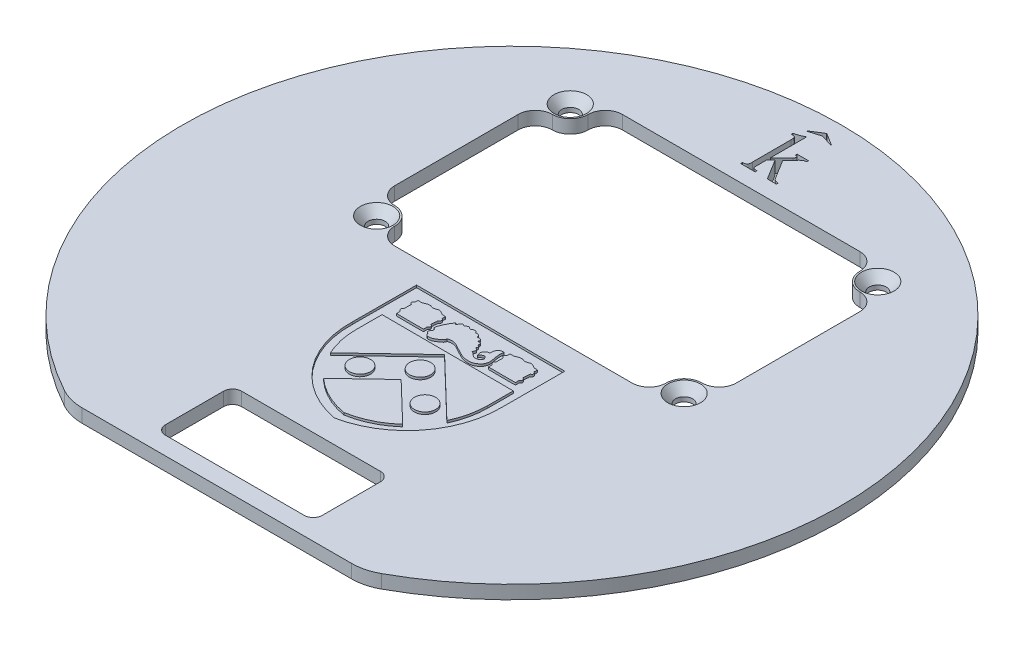
from build123d import *
from OCP.BRepFilletAPI import BRepFilletAPI_MakeChamfer

# Parameters (mm, degrees)
BOSS_EXTRUDE1_DEPTH = 3
SKETCH2_R           = 1.905
CUT_EXTRUDE1_DEPTH  = 104.987980075
SKETCH3_R           = 2.359015219
CUT_EXTRUDE2_DEPTH  = 0.5
CUT_EXTRUDE3_DEPTH  = 104.974756693
CHAMFER1_SIZE       = 2
CHAMFER1_SIZE2      = 1.738573476


with BuildPart() as part:
    # Sketch1 → Boss-Extrude1 (new body)
    with BuildSketch(Plane(origin=(0, 0, 0), x_dir=(1, 0, 0), z_dir=(0, 1, 0))):
        with BuildLine():
            Line((-30.029977361, -65.812867647), (30.029977361, -65.812867647))
            ThreePointArc((30.029977361, -65.812867647), (32.757823419, -65.469267409), (35.315253377, -64.459932353))
            ThreePointArc((35.315253377, -64.459932353), (0, 73.5), (-35.315253377, -64.459932353))
            ThreePointArc((-35.315253377, -64.459932353), (-32.757823419, -65.469267409), (-30.029977361, -65.812867647))
        make_face()
    extrude(amount=BOSS_EXTRUDE1_DEPTH)

    # Sketch2 → Cut-Extrude1 (cut, through all)
    with BuildSketch(Plane(origin=(0, 3, 0), x_dir=(1, 0, 0), z_dir=(0, 1, 0))):
        with Locations(Location((34.29, 4.117132353, 0), (0, 0, 270))):
            Circle(SKETCH2_R)
        with Locations(Location((-34.29, 4.117132353, 0), (0, 0, 270))):
            Circle(SKETCH2_R)
        with Locations(Location((34.29, 47.297132353, 0), (0, 0, 270))):
            Circle(SKETCH2_R)
        with Locations(Location((-34.29, 47.297132353, 0), (0, 0, 270))):
            Circle(SKETCH2_R)
        with BuildLine():
            Line((-38.1, 11.927132353), (-38.1, 39.487132353))
            ThreePointArc((-38.1, 39.487132353), (-36.984076836, 42.181209189), (-34.29, 43.297132353))
            ThreePointArc((-34.29, 43.297132353), (-31.461572875, 44.468705228), (-30.29, 47.297132353))
            ThreePointArc((-30.29, 47.297132353), (-29.174076836, 49.991209189), (-26.48, 51.107132353))
            Line((-26.48, 51.107132353), (26.48, 51.107132353))
            ThreePointArc((26.48, 51.107132353), (29.174076836, 49.991209189), (30.29, 47.297132353))
            ThreePointArc((30.29, 47.297132353), (31.461572875, 44.468705228), (34.29, 43.297132353))
            ThreePointArc((34.29, 43.297132353), (36.984076836, 42.181209189), (38.1, 39.487132353))
            Line((38.1, 39.487132353), (38.1, 11.927132353))
            ThreePointArc((38.1, 11.927132353), (36.984076836, 9.233055517), (34.29, 8.117132353))
            ThreePointArc((34.29, 8.117132353), (31.461572875, 6.945559478), (30.29, 4.117132353))
            ThreePointArc((30.29, 4.117132353), (29.174076836, 1.423055517), (26.48, 0.307132353))
            Line((26.48, 0.307132353), (-26.48, 0.307132353))
            ThreePointArc((-26.48, 0.307132353), (-29.174076836, 1.423055517), (-30.29, 4.117132353))
            ThreePointArc((-30.29, 4.117132353), (-31.461572875, 6.945559478), (-34.29, 8.117132353))
            ThreePointArc((-34.29, 8.117132353), (-36.984076836, 9.233055517), (-38.1, 11.927132353))
        make_face()
        with BuildLine():
            Line((-15.5, -61.812867647), (15.5, -61.812867647))
            ThreePointArc((15.5, -61.812867647), (16.914213562, -61.227081209), (17.5, -59.812867647))
            Line((17.5, -59.812867647), (17.5, -46.812867647))
            ThreePointArc((17.5, -46.812867647), (16.914213562, -45.398654085), (15.5, -44.812867647))
            Line((15.5, -44.812867647), (-15.5, -44.812867647))
            ThreePointArc((-15.5, -44.812867647), (-16.914213562, -45.398654085), (-17.5, -46.812867647))
            Line((-17.5, -46.812867647), (-17.5, -59.812867647))
            ThreePointArc((-17.5, -59.812867647), (-16.914213562, -61.227081209), (-15.5, -61.812867647))
        make_face()
    extrude(amount=-CUT_EXTRUDE1_DEPTH, mode=Mode.SUBTRACT)

    # Sketch3 → Cut-Extrude2 (cut)
    # profile 1 of 3: a face of its own
    with BuildSketch(Plane(origin=(0, 3, 0), x_dir=(1, 0, 0), z_dir=(0, 1, 0))):
        with BuildLine():
            Line((-2.693134868, 68.535327227), (-0.026575904, 70.208580735))
            ThreePointArc((-0.026575904, 70.208580735), (0, 70.216228387), (0.026575904, 70.208580735))
            Line((0.026575904, 70.208580735), (2.693134868, 68.535327227))
            ThreePointArc((2.693134868, 68.535327227), (2.712147073, 68.472438951), (2.652448687, 68.445007182))
            Line((2.652448687, 68.445007182), (0, 69.225256992))
            Line((0, 69.225256992), (-2.652448687, 68.445007182))
            ThreePointArc((-2.652448687, 68.445007182), (-2.712147073, 68.472438951), (-2.693134868, 68.535327227))
        make_face()
    # profile 2 of 3: a face of its own
    with BuildSketch(Plane(origin=(0, 3, 0), x_dir=(1, 0, 0), z_dir=(0, 1, 0))):
        with BuildLine():
            Line((-1.588743463, 67.164413263), (-1.755732468, 67.278490361))
            add(Edge.make_bspline(
                [(-1.755732468, 67.278490361), (-1.832549533, 67.227230697), (-1.984648639, 67.125735685), (-2.222419823, 66.994786105), (-2.464077879, 66.881851597), (-2.710596565, 66.781135583), (-2.969569879, 66.697164946), (-3.241490234, 66.621894904), (-3.530063909, 66.557581345), (-3.728806169, 66.526124216), (-3.830845923, 66.509973259)],
                knots=[0, 0, 0, 0, 0.99219527, 1.964563641, 2.913725659, 3.858095412, 4.824613577, 5.837792226, 6.889862931, 8, 8, 8, 8], degree=3))
            Line((-3.830845923, 66.509973259), (-3.829172774, 66.108082379))
            add(Edge.make_bspline(
                [(-3.829172774, 66.108082379), (-3.774105613, 66.108409425), (-3.668873212, 66.109034404), (-3.518862518, 66.104840232), (-3.383546213, 66.094375577), (-3.265155852, 66.072782419), (-3.160883193, 66.04731835), (-3.071553221, 66.014268735), (-3.000266077, 65.967658065), (-2.939938984, 65.917450087), (-2.893339202, 65.851862148), (-2.857199347, 65.771699484), (-2.826894126, 65.675281315), (-2.800684924, 65.56392077), (-2.786418221, 65.435385438), (-2.772957389, 65.291284648), (-2.772796419, 65.130361874), (-2.774640292, 65.017575593), (-2.775600635, 64.958833192)],
                knots=[0, 0, 0, 0, 1.376985379, 2.631395473, 3.752347301, 4.766905578, 5.636427879, 6.436770196, 7.132443207, 7.75719583, 8.388061638, 9.12420934, 9.948179583, 10.912904473, 11.979647863, 13.178681864, 14.530574826, 16, 16, 16, 16], degree=3))
            Line((-2.775600635, 64.958833192), (-2.773252718, 56.449231137))
            add(Edge.make_bspline(
                [(-2.773252718, 56.449231137), (-2.772214018, 56.387960757), (-2.770219198, 56.270291156), (-2.771391408, 56.102281121), (-2.78161931, 55.951842556), (-2.793829567, 55.817970102), (-2.817575395, 55.701848787), (-2.845765127, 55.602072587), (-2.877117213, 55.517481564), (-2.921124144, 55.448626542), (-2.977544093, 55.391778016), (-3.050669341, 55.347485193), (-3.138631439, 55.310304699), (-3.243321352, 55.279320759), (-3.366524711, 55.259910615), (-3.506162492, 55.245514471), (-3.663203904, 55.241809344), (-3.772882826, 55.244162486), (-3.830845923, 55.245406074)],
                knots=[0, 0, 0, 0, 1.483538914, 2.84913251, 4.065244707, 5.13334905, 6.100365284, 6.92875801, 7.643656089, 8.274928736, 8.891793445, 9.565242324, 10.329735783, 11.199843743, 12.200672305, 13.344232496, 14.596480465, 16, 16, 16, 16], degree=3))
            Line((-3.830845923, 55.245406074), (-3.829172774, 54.812967025))
            Line((-3.829172774, 54.812967025), (-0.581273582, 54.812967025))
            Line((-0.581273582, 54.812967025), (-0.581273582, 55.24540837))
            add(Edge.make_bspline(
                [(-0.581273582, 55.24540837), (-0.636624311, 55.24420349), (-0.741337005, 55.241924095), (-0.890368116, 55.245104299), (-1.022656679, 55.26091815), (-1.139693889, 55.27701726), (-1.240903316, 55.305564858), (-1.324498674, 55.342477108), (-1.394120006, 55.385368645), (-1.448069464, 55.439170402), (-1.489772573, 55.506887158), (-1.520871776, 55.590297977), (-1.549437281, 55.689117264), (-1.569863128, 55.804919825), (-1.582989702, 55.937697493), (-1.592695809, 56.087409328), (-1.5947235, 56.254472442), (-1.590798425, 56.371167749), (-1.588743463, 56.432263247)],
                knots=[0, 0, 0, 0, 1.377886396, 2.606690134, 3.704658506, 4.691806464, 5.543360921, 6.311374855, 6.960297786, 7.566839843, 8.188849503, 8.923736021, 9.775290478, 10.746525042, 11.844493415, 13.094607919, 14.478890205, 16, 16, 16, 16], degree=3))
            Line((-1.588743463, 56.432263247), (-1.588743463, 58.336304663))
            Line((-1.588743463, 58.336304663), (-0.630022125, 59.328645052))
            Line((-0.630022125, 59.328645052), (2.143462401, 54.812967025))
            Line((2.143462401, 54.812967025), (4.166694463, 54.812967025))
            Line((4.166694463, 54.812967025), (4.166694463, 55.22995297))
            add(Edge.make_bspline(
                [(4.166694463, 55.22995297), (4.101669564, 55.227779441), (3.975059113, 55.223547346), (3.791318365, 55.247963099), (3.617114107, 55.28107136), (3.451013431, 55.337922782), (3.290164055, 55.426269638), (3.14173098, 55.562509347), (2.992374305, 55.733567663), (2.907560866, 55.870671313), (2.862558488, 55.943419105)],
                knots=[0, 0, 0, 0, 0.984414491, 1.91676056, 2.801699979, 3.669179448, 4.567638625, 5.560693888, 6.705693592, 8, 8, 8, 8], degree=3))
            Line((2.862558488, 55.943419105), (0.27995067, 60.125770939))
            Line((0.27995067, 60.125770939), (2.065118169, 61.947772965))
            add(Edge.make_bspline(
                [(2.065118169, 61.947772965), (2.110902524, 61.994071272), (2.199304609, 62.083465714), (2.336921668, 62.200200215), (2.471286429, 62.296283635), (2.606282717, 62.369151508), (2.746476352, 62.421547331), (2.894516119, 62.459143642), (3.054623606, 62.480897436), (3.164883856, 62.481431944), (3.222140958, 62.481709509)],
                knots=[0, 0, 0, 0, 1.184269341, 2.286629972, 3.279203951, 4.18475382, 5.068961587, 5.99547167, 6.959067459, 8, 8, 8, 8], degree=3))
            Line((3.222140958, 62.481709509), (3.224488875, 62.916496475))
            Line((3.224488875, 62.916496475), (0.686259674, 62.916496475))
            Line((0.686259674, 62.916496475), (0.686259674, 62.484055131))
            add(Edge.make_bspline(
                [(0.686259674, 62.484055131), (0.73326394, 62.482797536), (0.821882979, 62.480426541), (0.946169955, 62.472500426), (1.051117411, 62.455462252), (1.137972063, 62.437306415), (1.202696668, 62.405693423), (1.251526189, 62.370618052), (1.280581111, 62.323571899), (1.280772082, 62.289323123), (1.280865662, 62.272540621)],
                knots=[0, 0, 0, 0, 1.638837204, 3.089765864, 4.332966459, 5.345953299, 6.163994169, 6.824817916, 7.424140098, 8, 8, 8, 8], degree=3))
            add(Edge.make_bspline(
                [(1.280865662, 62.272540621), (1.27480377, 62.239006334), (1.260695753, 62.160961012), (1.186515825, 62.043760246), (1.07625371, 61.910067192), (0.985645134, 61.818202456), (0.935384465, 61.767244993)],
                knots=[0, 0, 0, 0, 0.651763068, 1.516867163, 2.622603691, 4, 4, 4, 4], degree=3))
            Line((0.935384465, 61.767244993), (-1.556244434, 59.247305676))
            Line((-1.556244434, 59.247305676), (-1.588743463, 59.247305676))
            Line((-1.588743463, 59.247305676), (-1.588743463, 67.164413263))
        make_face()
    # profile 3 of 3: a face of its own
    with BuildSketch(Plane(origin=(0, 3, 0), x_dir=(1, 0, 0), z_dir=(0, 1, 0))):
        with BuildLine():
            Line((-16.470981421, -4.808010158), (10.814898306, -4.897023363))
            Line((10.814898306, -4.897023363), (16.697915401, -4.916215202))
            Line((16.697915401, -4.916215202), (16.651431044, -19.165410763))
            ThreePointArc((16.651431044, -19.165410763), (12.00738353, -32.398319242), (0, -39.643992771))
            ThreePointArc((0, -39.643992771), (-12.053441019, -32.395220123), (-16.517465778, -19.057205718))
            Line((-16.517465778, -19.057205718), (-16.485508628, -9.261142746))
            Line((-16.485508628, -9.261142746), (-16.470981421, -4.808010158))
        make_face()
        with Locations(Location((7.320101243, -26.708540039, 0), (0, 0, 270))):
            Circle(SKETCH3_R, mode=Mode.SUBTRACT)
        with Locations(Location((-7.235549125, -26.661055951, 0), (0, 0, 270))):
            Circle(SKETCH3_R, mode=Mode.SUBTRACT)
        with Locations(Location((0.062321726, -20.540050638, 0), (0, 0, 270))):
            Circle(SKETCH3_R, mode=Mode.SUBTRACT)
        with BuildLine():
            Line((0.08004657, -15.106722514), (13.074502178, -27.588397202))
            ThreePointArc((13.074502178, -27.588397202), (14.314771928, -23.960219393), (14.743209199, -20.149919566))
            Line((14.743209199, -20.149919566), (14.761768322, -14.460853553))
            Line((14.761768322, -14.460853553), (-14.597148773, -14.365077594))
            Line((-14.597148773, -14.365077594), (-14.615707897, -20.054143607))
            ThreePointArc((-14.615707897, -20.054143607), (-14.212139737, -23.867157639), (-12.995568138, -27.503350264))
            Line((-12.995568138, -27.503350264), (0.08004657, -15.106722514))
        make_face(mode=Mode.SUBTRACT)
        with BuildLine():
            Line((-8.831024098, -33.187528193), (0.048525621, -24.769073313))
            Line((0.048525621, -24.769073313), (8.872960818, -33.245282917))
            ThreePointArc((8.872960818, -33.245282917), (4.743370964, -36.011033202), (0.006937525, -37.517381529))
            ThreePointArc((0.006937525, -37.517381529), (-4.719567054, -35.980162786), (-8.831024098, -33.187528193))
        make_face(mode=Mode.SUBTRACT)
        with BuildLine():
            add(Edge.make_bspline(
                [(7.357481872, -12.279858863), (7.355766939, -12.333701089), (7.352220775, -12.408052634), (7.349794751, -12.500685791), (7.355203186, -12.548150367), (7.351186054, -12.607988403), (7.429007705, -12.602929343), (7.610022366, -12.597956659), (8.143286982, -12.614119636), (8.918189984, -12.593542954), (9.762189895, -12.622671503), (10.412098456, -12.630977508), (10.899551074, -12.625876241), (11.307518252, -12.620157453), (11.684828624, -12.625524183), (12.026324142, -12.61760064), (12.340781403, -12.621676176), (12.650501648, -12.618344428), (12.93987421, -12.603267434), (13.163825069, -12.614130375), (13.349541705, -12.598234942), (13.39827292, -12.42891283), (13.377358709, -12.250943536), (13.388788502, -12.053250365), (13.377015895, -11.882422209), (13.408323565, -11.747661847), (13.523677747, -11.653503991), (13.628137383, -11.522170953), (13.725030966, -11.341311532), (13.665148976, -11.159483782), (13.585923053, -11.013460721), (13.4395977, -10.957312897), (13.26762091, -10.915046329), (13.321766563, -10.673652565), (13.325104231, -10.41146718), (13.333974438, -10.059253124), (13.405952532, -9.750322426), (13.37930486, -9.506093906), (13.432032803, -9.289021617), (13.607672713, -9.235324534), (13.758139316, -9.085510044), (13.698470298, -8.887396451), (13.735316394, -8.699363678), (13.635823239, -8.605665792), (13.534539249, -8.537487629), (13.351608182, -8.501212057), (13.450352391, -8.281032301), (13.416072214, -8.05756016), (13.429551774, -7.918046969), (13.424786232, -7.807931108)],
                knots=[0.498850529, 0.498850529, 0.498850529, 0.498850529, 0.505805281, 0.508518005, 0.510586676, 0.512308685, 0.514943831, 0.518127891, 0.537690902, 0.580941513, 0.619697701, 0.645981713, 0.664756575, 0.682488522, 0.698550468, 0.713362303, 0.726503895, 0.739021436, 0.753420653, 0.763224698, 0.769274242, 0.774450138, 0.783248293, 0.792985724, 0.799592531, 0.805526644, 0.809721918, 0.818280397, 0.827588735, 0.83398197, 0.842184813, 0.847585853, 0.85446252, 0.860726442, 0.874345035, 0.890729688, 0.905221659, 0.914603521, 0.922884949, 0.930829358, 0.936714161, 0.948198451, 0.954622091, 0.959784459, 0.964102621, 0.971407316, 0.977533935, 0.989080574, 1, 1, 1, 1], degree=3))
            add(Edge.make_bspline(
                [(13.424786232, -7.807931108), (13.42460476, -7.803737886), (13.422625928, -7.761192179), (13.421060085, -7.705343524), (13.352096043, -7.717711127), (13.277186229, -7.718426819), (13.131955229, -7.712268831), (12.924298537, -7.721058476), (12.700789954, -7.69245505), (12.501561819, -7.607437261), (12.323210965, -7.529694074), (12.156464545, -7.430455873), (12.008967899, -7.340823292), (11.849014972, -7.274949036), (11.710532613, -7.176409802), (11.54888182, -7.199026456), (11.397392865, -7.17971048), (11.225516417, -7.249872008), (11.011378008, -7.320720147), (10.746618182, -7.406494503), (10.483042389, -7.483524434), (10.230159565, -7.486215872), (10.022752238, -7.424667421), (9.835170286, -7.342395051), (9.611348104, -7.230535597), (9.34871333, -7.304828523), (9.07418548, -7.283525356), (8.832810169, -7.402571297), (8.56131448, -7.486641897), (8.292973549, -7.624631901), (8.005142163, -7.708400472), (7.746627332, -7.676941825), (7.53769765, -7.69213532), (7.388594253, -7.683179256), (7.239215139, -7.705837152), (7.23173912, -7.874699111), (7.224766389, -8.025797662), (7.232293755, -8.180397343), (7.212484965, -8.38110466), (6.976751499, -8.462730633), (6.822553075, -8.705867613), (6.907023796, -8.954643387), (7.061914584, -9.077648656), (7.210762424, -9.131309635), (7.293250464, -9.328255592), (7.222070947, -9.752200782), (7.246073152, -10.202700668), (7.242599254, -10.585869722), (7.25532341, -10.704545301), (7.247896001, -10.799836164), (7.128903352, -10.887608306), (6.999415219, -11.022589056), (6.924662536, -11.224817067), (6.985341655, -11.368333868), (7.038698127, -11.464192479), (7.08109244, -11.568590169), (7.214898136, -11.58599175), (7.245955174, -11.708999565), (7.344732746, -11.736698043), (7.368386788, -11.841665728), (7.361061795, -12.01408604), (7.360853254, -12.174010627), (7.357481872, -12.279858863)],
                knots=[0, 0, 0, 0, 0.000415813, 0.004158127, 0.005920058, 0.008171883, 0.014221645, 0.024319868, 0.035130282, 0.042797179, 0.052137886, 0.060173919, 0.067793683, 0.074267456, 0.082645389, 0.088397068, 0.094591184, 0.102070876, 0.111696773, 0.123858525, 0.137901284, 0.146871361, 0.156007276, 0.165455978, 0.173525509, 0.18720692, 0.19868034, 0.208400909, 0.221109576, 0.235370207, 0.247248388, 0.258945255, 0.268632265, 0.27384039, 0.278898891, 0.285383492, 0.291980982, 0.299350152, 0.305497384, 0.315904567, 0.327706291, 0.33903205, 0.345870779, 0.353016052, 0.358205111, 0.371688102, 0.40726051, 0.416587254, 0.42085715, 0.422729798, 0.428555513, 0.438116711, 0.447642761, 0.453770675, 0.457354862, 0.462099697, 0.467134811, 0.472154107, 0.476238205, 0.478456776, 0.485178207, 0.498850529, 0.498850529, 0.498850529, 0.498850529], degree=3))
        make_face(mode=Mode.SUBTRACT)
        with BuildLine():
            add(Edge.make_bspline(
                [(-13.216408652, -12.212741806), (-13.218123585, -12.266584032), (-13.221669749, -12.340935577), (-13.224095773, -12.433568734), (-13.218687339, -12.481033311), (-13.22270447, -12.540871346), (-13.144882819, -12.535812286), (-12.963868158, -12.530839602), (-12.430603542, -12.547002579), (-11.655700541, -12.526425897), (-10.81170063, -12.555554446), (-10.161792068, -12.563860451), (-9.67433945, -12.558759185), (-9.266372272, -12.553040396), (-8.8890619, -12.558407126), (-8.547566382, -12.550483583), (-8.233109121, -12.554559119), (-7.923388876, -12.551227371), (-7.634016314, -12.536150377), (-7.410065455, -12.547013318), (-7.224348819, -12.531117885), (-7.175617604, -12.361795773), (-7.196531815, -12.183826479), (-7.185102022, -11.986133308), (-7.196874629, -11.815305152), (-7.165566959, -11.68054479), (-7.050212777, -11.586386935), (-6.945753141, -11.455053896), (-6.848859559, -11.274194475), (-6.908741549, -11.092366726), (-6.987967472, -10.946343664), (-7.134292824, -10.89019584), (-7.306269614, -10.847929272), (-7.252123961, -10.606535508), (-7.248786294, -10.344350123), (-7.239916086, -9.992136067), (-7.167937992, -9.68320537), (-7.194585664, -9.438976849), (-7.141857721, -9.221904561), (-6.966217811, -9.168207477), (-6.815751208, -9.018392987), (-6.875420226, -8.820279394), (-6.83857413, -8.632246621), (-6.938067286, -8.538548735), (-7.039351276, -8.470370572), (-7.222282342, -8.434095), (-7.123538134, -8.213915244), (-7.15781831, -7.990443103), (-7.14433875, -7.850929912), (-7.149104292, -7.740814051)],
                knots=[0.498850529, 0.498850529, 0.498850529, 0.498850529, 0.505805281, 0.508518005, 0.510586676, 0.512308685, 0.514943831, 0.518127891, 0.537690902, 0.580941513, 0.619697701, 0.645981713, 0.664756575, 0.682488522, 0.698550468, 0.713362303, 0.726503895, 0.739021436, 0.753420653, 0.763224698, 0.769274242, 0.774450138, 0.783248293, 0.792985724, 0.799592531, 0.805526644, 0.809721918, 0.818280397, 0.827588735, 0.83398197, 0.842184813, 0.847585853, 0.85446252, 0.860726442, 0.874345035, 0.890729688, 0.905221659, 0.914603521, 0.922884949, 0.930829358, 0.936714161, 0.948198451, 0.954622091, 0.959784459, 0.964102621, 0.971407316, 0.977533935, 0.989080574, 1, 1, 1, 1], degree=3))
            add(Edge.make_bspline(
                [(-7.149104292, -7.740814051), (-7.149285764, -7.736620829), (-7.151264596, -7.694075122), (-7.152830439, -7.638226467), (-7.221794481, -7.65059407), (-7.296704295, -7.651309762), (-7.441935295, -7.645151774), (-7.649591987, -7.653941419), (-7.87310057, -7.625337993), (-8.072328706, -7.540320204), (-8.250679559, -7.462577017), (-8.417425979, -7.363338817), (-8.564922625, -7.273706235), (-8.724875552, -7.207831979), (-8.863357911, -7.109292745), (-9.025008704, -7.131909399), (-9.176497659, -7.112593423), (-9.348374107, -7.182754951), (-9.562512516, -7.25360309), (-9.827272343, -7.339377446), (-10.090848135, -7.416407377), (-10.343730959, -7.419098815), (-10.551138286, -7.357550364), (-10.738720239, -7.275277994), (-10.96254242, -7.16341854), (-11.225177194, -7.237711466), (-11.499705044, -7.216408299), (-11.741080355, -7.33545424), (-12.012576045, -7.41952484), (-12.280916975, -7.557514844), (-12.568748361, -7.641283416), (-12.827263193, -7.609824768), (-13.036192875, -7.625018263), (-13.185296271, -7.616062199), (-13.334675386, -7.638720095), (-13.342151404, -7.807582054), (-13.349124135, -7.958680605), (-13.341596769, -8.113280286), (-13.361405559, -8.313987603), (-13.597139025, -8.395613576), (-13.751337449, -8.638750556), (-13.666866729, -8.88752633), (-13.511975941, -9.010531599), (-13.3631281, -9.064192578), (-13.28064006, -9.261138535), (-13.351819577, -9.685083725), (-13.327817372, -10.135583611), (-13.33129127, -10.518752665), (-13.318567115, -10.637428244), (-13.325994523, -10.732719107), (-13.444987172, -10.820491249), (-13.574475305, -10.955471999), (-13.649227988, -11.15770001), (-13.58854887, -11.301216811), (-13.535192397, -11.397075423), (-13.492798085, -11.501473112), (-13.358992388, -11.518874693), (-13.327935351, -11.641882508), (-13.229157778, -11.669580986), (-13.205503736, -11.774548671), (-13.212828729, -11.946968983), (-13.213037271, -12.10689357), (-13.216408652, -12.212741806)],
                knots=[0, 0, 0, 0, 0.000415813, 0.004158127, 0.005920058, 0.008171883, 0.014221645, 0.024319868, 0.035130282, 0.042797179, 0.052137886, 0.060173919, 0.067793683, 0.074267456, 0.082645389, 0.088397068, 0.094591184, 0.102070876, 0.111696773, 0.123858525, 0.137901284, 0.146871361, 0.156007276, 0.165455978, 0.173525509, 0.18720692, 0.19868034, 0.208400909, 0.221109576, 0.235370207, 0.247248388, 0.258945255, 0.268632265, 0.27384039, 0.278898891, 0.285383492, 0.291980982, 0.299350152, 0.305497384, 0.315904567, 0.327706291, 0.33903205, 0.345870779, 0.353016052, 0.358205111, 0.371688102, 0.40726051, 0.416587254, 0.42085715, 0.422729798, 0.428555513, 0.438116711, 0.447642761, 0.453770675, 0.457354862, 0.462099697, 0.467134811, 0.472154107, 0.476238205, 0.478456776, 0.485178207, 0.498850529, 0.498850529, 0.498850529, 0.498850529], degree=3))
        make_face(mode=Mode.SUBTRACT)
        with BuildLine():
            add(Edge.make_bspline(
                [(3.529178726, -12.13539403), (3.420214113, -12.062826625), (3.162061827, -11.908286192), (2.985400164, -11.60074283), (2.527869527, -11.479546472), (2.658347864, -11.298032605), (2.710305473, -11.141681619), (2.835991298, -10.907525076), (2.721362637, -10.593390559), (2.547465243, -10.398642716), (2.170074333, -10.307169669), (2.314158118, -10.186157507), (2.409739969, -10.075796958), (2.390556321, -9.860664819), (2.274706029, -9.613622274), (1.927519741, -9.64316009), (1.980132129, -9.439955755), (1.965205285, -9.307065563), (1.988251331, -9.130154583), (1.902469247, -8.921616328), (1.661809463, -8.798472352), (1.483737989, -8.812015743), (1.156412286, -8.855826575), (1.254402019, -8.755663937), (1.295829004, -8.664876172), (1.301920937, -8.490829723), (1.222877447, -8.280804373), (1.078024784, -8.047157544), (0.838160897, -8.097021692), (0.647926616, -8.043508794), (0.466694398, -8.092112943), (0.261926085, -8.061867942), (0.265968929, -7.837635027), (0.195711944, -7.630218077), (-0.015782887, -7.424887827), (-0.30087254, -7.407962044), (-0.504846497, -7.415896024), (-0.655174342, -7.577132221), (-0.648378074, -7.365546954), (-0.747587889, -7.282532559), (-0.826681019, -7.125168923), (-1.071187713, -7.038315771), (-1.36495947, -7.058639972), (-1.721726011, -7.077398904), (-1.819382934, -7.339701012), (-2.053110813, -7.366894025), (-2.228400475, -7.164824022), (-2.525445375, -6.972008138), (-2.894984076, -7.112960898), (-3.08897487, -7.284848778), (-3.253501043, -7.473166298), (-3.420133438, -7.342671009), (-3.581666543, -7.167125366), (-3.908469432, -7.177811485), (-4.031539597, -7.387002048), (-4.178749301, -7.516354405), (-4.262915493, -7.759172781), (-4.407060666, -7.900550033), (-4.528204574, -8.064121522), (-4.661604679, -7.974413272), (-4.605965501, -7.842134645), (-4.741569558, -7.75597504), (-4.851073509, -7.87565025), (-4.998450101, -7.97476471), (-5.068155876, -8.221820052), (-5.252905496, -8.393355989), (-5.344046408, -8.653317594), (-5.534398474, -8.866200129), (-5.592146613, -9.117683909), (-5.733068981, -9.319101339), (-5.818796604, -9.554802909), (-5.969787221, -9.889978748), (-6.069877854, -10.234901389), (-6.244705966, -10.552456328), (-6.248516721, -10.840647478), (-6.293223818, -11.201360404), (-6.042216916, -11.247299148), (-5.936579499, -11.362096043), (-5.876409267, -11.519011357), (-5.898159824, -11.687563908), (-5.91572941, -11.887240127), (-6.085821885, -12.01657304), (-6.193487882, -12.17071668), (-6.251342521, -12.341541218), (-6.301884546, -12.489902776), (-6.263621583, -12.650524325), (-6.129101064, -12.727168614), (-6.021987546, -12.831544704), (-5.842985732, -12.836552427), (-5.84390027, -12.967382919), (-5.836975084, -13.07081409), (-5.745636152, -13.179765863), (-5.657175368, -13.306640279), (-5.504106784, -13.408219889), (-5.340730053, -13.492325757), (-5.149814651, -13.468728082), (-4.969320253, -13.469434193), (-4.786137545, -13.437717024), (-4.607160944, -13.413592635), (-4.431347713, -13.34553616), (-4.261981196, -13.264866126), (-4.101808846, -13.170499355), (-3.948338351, -13.091457388), (-3.798259484, -12.990766552), (-3.628507288, -12.889666971), (-3.460642602, -12.779972974), (-3.306645347, -12.619808437), (-3.093603813, -12.507590191), (-2.890772096, -12.342533246), (-2.775527112, -12.162674622), (-2.711323161, -12.007662431), (-2.704350006, -11.884214893), (-2.645755724, -11.837028788), (-2.627466043, -11.823690432)],
                knots=[0.503539842, 0.503539842, 0.503539842, 0.503539842, 0.511609706, 0.52220684, 0.528988338, 0.530283877, 0.535244544, 0.540022255, 0.546491971, 0.554231912, 0.559495642, 0.561430627, 0.564066169, 0.569047614, 0.573905718, 0.58053121, 0.582626375, 0.585518827, 0.58937543, 0.593764405, 0.599166136, 0.604468965, 0.608979798, 0.610226717, 0.61169417, 0.6156405, 0.6206212, 0.626660263, 0.630204093, 0.63507639, 0.638903039, 0.642599156, 0.645688484, 0.651374935, 0.656857791, 0.663244836, 0.668689857, 0.670475091, 0.673630626, 0.676470062, 0.679384351, 0.68431639, 0.691667728, 0.699023752, 0.704595436, 0.706451634, 0.713005088, 0.72010853, 0.727879105, 0.735424724, 0.738140835, 0.741636794, 0.746253267, 0.754491304, 0.756829068, 0.761480824, 0.766876234, 0.772387513, 0.775469761, 0.777348782, 0.78036008, 0.782862737, 0.784515786, 0.789780164, 0.794242171, 0.800092658, 0.805462724, 0.811530968, 0.817965278, 0.821499433, 0.827138954, 0.833928983, 0.844988488, 0.850268952, 0.856355628, 0.864596796, 0.867347892, 0.87117768, 0.874119486, 0.877799137, 0.881988234, 0.886256332, 0.8907345, 0.893903514, 0.897771276, 0.900648497, 0.903552803, 0.907181028, 0.910482342, 0.912346826, 0.914500854, 0.917162742, 0.921062891, 0.924401813, 0.928831503, 0.93237902, 0.936418068, 0.940421031, 0.944240355, 0.94793611, 0.952415205, 0.956245278, 0.959825366, 0.963452431, 0.967794451, 0.972483508, 0.97622608, 0.981896941, 0.987765633, 0.992765785, 0.995331787, 0.998583298, 1, 1, 1, 1], degree=3))
            add(Edge.make_bspline(
                [(-2.627466043, -11.823690432), (-2.515202083, -11.741818217), (-2.268155158, -11.657414129), (-1.879886735, -11.618915423), (-1.493291958, -11.605700374), (-1.103362002, -11.679915033), (-0.733880608, -11.789146332), (-0.400879544, -12.002945396), (-0.011824056, -12.180654777), (0.430985, -12.451125844), (0.953908579, -12.692104423), (1.478605514, -13.004126144), (2.016421612, -13.266705499), (2.574950825, -13.504202887), (3.215097723, -13.646186385), (3.875063502, -13.695605612), (4.545833731, -13.675747773), (5.119817929, -13.447645119), (5.602789065, -13.16208867), (6.012725829, -12.825716279), (6.301471769, -12.380307623), (6.446686947, -11.957744904), (6.555639524, -11.403350374), (6.474484435, -10.824425719), (6.326908008, -10.176819414), (6.251562836, -9.624964674), (6.202912614, -9.162087435), (6.177538596, -8.722720593), (6.235687338, -8.413881743), (6.2872084, -8.19931774), (6.29249679, -8.042951738), (6.111168406, -8.060462379), (5.941423212, -8.032855883), (5.741706193, -8.077026685), (5.477444181, -8.137083674), (5.166867662, -8.357515511), (4.918413426, -8.828523042), (4.835872484, -9.318302478), (4.839002189, -9.61864727), (4.824225695, -9.794110251), (4.6886375, -9.762417813), (4.571714762, -9.797977767), (4.403219601, -9.844719837), (4.20891124, -9.94763446), (3.986319631, -10.10019937), (3.847732865, -10.31840889), (3.739695723, -10.517754634), (3.679168257, -10.737787868), (3.728230085, -10.960437024), (3.75749423, -11.182472862), (3.788677542, -11.368920604), (3.855191177, -11.465007294), (3.880319136, -11.604932159), (3.931993949, -11.485740908), (3.985952906, -11.415965958), (4.071096382, -11.30344645), (4.210817108, -11.177945907), (4.392056335, -11.050505872), (4.614323053, -10.9402352), (4.911507421, -10.898965252), (5.108048531, -11.123144238), (5.319806722, -11.363305808), (5.36790647, -11.734790731), (5.161277276, -12.050252741), (4.852059849, -12.28901275), (4.423730142, -12.335355093), (3.933309913, -12.428497884), (3.667022934, -12.227194441), (3.529178726, -12.13539403)],
                knots=[0, 0, 0, 0, 0.008695862, 0.016350714, 0.024971765, 0.033313924, 0.04166255, 0.049421991, 0.058481824, 0.069010977, 0.082569971, 0.095276239, 0.108036432, 0.120861367, 0.134013601, 0.149753564, 0.163233245, 0.176471057, 0.188702038, 0.19914396, 0.210069954, 0.222174124, 0.22754605, 0.2461091, 0.25873884, 0.27021332, 0.281692538, 0.288503278, 0.298433423, 0.301049296, 0.303481004, 0.306413354, 0.310112757, 0.315317286, 0.318981623, 0.327539121, 0.338481512, 0.352538141, 0.357682788, 0.359514957, 0.361770374, 0.364544344, 0.367746105, 0.372776554, 0.378625824, 0.384734226, 0.389046039, 0.393177412, 0.398997916, 0.403225057, 0.407862902, 0.410163658, 0.411894362, 0.413632509, 0.415370657, 0.418457445, 0.422208833, 0.427514096, 0.432474764, 0.438268589, 0.444894082, 0.449939906, 0.459008677, 0.466064492, 0.473295623, 0.483196115, 0.49333117, 0.503539842, 0.503539842, 0.503539842, 0.503539842], degree=3))
        make_face(mode=Mode.SUBTRACT)
    extrude(amount=-CUT_EXTRUDE2_DEPTH, mode=Mode.SUBTRACT)

    # Sketch4 → Cut-Extrude3 (cut, through all)
    with BuildSketch(Plane(origin=(0, 2.5, 0), x_dir=(1, 0, 0), z_dir=(0, 1, 0))):
        with BuildLine():
            Line((-2.652448687, 68.445007182), (0, 69.225256992))
            Line((0, 69.225256992), (2.652448687, 68.445007182))
            ThreePointArc((2.652448687, 68.445007182), (2.712147073, 68.472438951), (2.693134868, 68.535327227))
            Line((2.693134868, 68.535327227), (0.026575904, 70.208580735))
            ThreePointArc((0.026575904, 70.208580735), (0, 70.216228387), (-0.026575904, 70.208580735))
            Line((-0.026575904, 70.208580735), (-2.693134868, 68.535327227))
            ThreePointArc((-2.693134868, 68.535327227), (-2.712147073, 68.472438951), (-2.652448687, 68.445007182))
        make_face()
        with BuildLine():
            Line((-1.588743463, 59.247305676), (-1.588743463, 67.164413263))
            Line((-1.588743463, 67.164413263), (-1.755732468, 67.278490361))
            add(Edge.make_bspline(
                [(-1.755732468, 67.278490361), (-1.832549533, 67.227230697), (-1.984648639, 67.125735685), (-2.222419823, 66.994786105), (-2.464077879, 66.881851597), (-2.710596565, 66.781135583), (-2.969569879, 66.697164946), (-3.241490234, 66.621894904), (-3.530063909, 66.557581345), (-3.728806169, 66.526124216), (-3.830845923, 66.509973259)],
                knots=[0, 0, 0, 0, 0.124024409, 0.245570455, 0.364215707, 0.482261926, 0.603076697, 0.729724028, 0.861232866, 1, 1, 1, 1], degree=3))
            Line((-3.830845923, 66.509973259), (-3.829172774, 66.108082379))
            add(Edge.make_bspline(
                [(-3.829172774, 66.108082379), (-3.774105613, 66.108409425), (-3.668873212, 66.109034404), (-3.518862518, 66.104840232), (-3.383546213, 66.094375577), (-3.265155852, 66.072782419), (-3.160883193, 66.04731835), (-3.071553221, 66.014268735), (-3.000266077, 65.967658065), (-2.939938984, 65.917450087), (-2.893339202, 65.851862148), (-2.857199347, 65.771699484), (-2.826894126, 65.675281315), (-2.800684924, 65.56392077), (-2.786418221, 65.435385438), (-2.772957389, 65.291284648), (-2.772796419, 65.130361874), (-2.774640292, 65.017575593), (-2.775600635, 64.958833192)],
                knots=[0, 0, 0, 0, 0.086061586, 0.164462217, 0.234521706, 0.297931599, 0.352276742, 0.402298137, 0.4457777, 0.484824739, 0.524253852, 0.570263084, 0.621761224, 0.68205653, 0.748727991, 0.823667616, 0.908160927, 1, 1, 1, 1], degree=3))
            Line((-2.775600635, 64.958833192), (-2.773252718, 56.449231137))
            add(Edge.make_bspline(
                [(-2.773252718, 56.449231137), (-2.772214018, 56.387960757), (-2.770219198, 56.270291156), (-2.771391408, 56.102281121), (-2.78161931, 55.951842556), (-2.793829567, 55.817970102), (-2.817575395, 55.701848787), (-2.845765127, 55.602072587), (-2.877117213, 55.517481564), (-2.921124144, 55.448626542), (-2.977544093, 55.391778016), (-3.050669341, 55.347485193), (-3.138631439, 55.310304699), (-3.243321352, 55.279320759), (-3.366524711, 55.259910615), (-3.506162492, 55.245514471), (-3.663203904, 55.241809344), (-3.772882826, 55.244162486), (-3.830845923, 55.245406074)],
                knots=[0, 0, 0, 0, 0.092721182, 0.178070782, 0.254077794, 0.320834316, 0.38127283, 0.433047376, 0.477728506, 0.517183046, 0.55573709, 0.597827645, 0.645608486, 0.699990234, 0.762542019, 0.834014531, 0.912280029, 1, 1, 1, 1], degree=3))
            Line((-3.830845923, 55.245406074), (-3.829172774, 54.812967025))
            Line((-3.829172774, 54.812967025), (-0.581273582, 54.812967025))
            Line((-0.581273582, 54.812967025), (-0.581273582, 55.24540837))
            add(Edge.make_bspline(
                [(-0.581273582, 55.24540837), (-0.636624311, 55.24420349), (-0.741337005, 55.241924095), (-0.890368116, 55.245104299), (-1.022656679, 55.26091815), (-1.139693889, 55.27701726), (-1.240903316, 55.305564858), (-1.324498674, 55.342477108), (-1.394120006, 55.385368645), (-1.448069464, 55.439170402), (-1.489772573, 55.506887158), (-1.520871776, 55.590297977), (-1.549437281, 55.689117264), (-1.569863128, 55.804919825), (-1.582989702, 55.937697493), (-1.592695809, 56.087409328), (-1.5947235, 56.254472442), (-1.590798425, 56.371167749), (-1.588743463, 56.432263247)],
                knots=[0, 0, 0, 0, 0.0861179, 0.162918133, 0.231541157, 0.293237904, 0.346460058, 0.394460928, 0.435018612, 0.47292749, 0.511803094, 0.557733501, 0.610955655, 0.671657815, 0.740280838, 0.818412995, 0.904930638, 1, 1, 1, 1], degree=3))
            Line((-1.588743463, 56.432263247), (-1.588743463, 58.336304663))
            Line((-1.588743463, 58.336304663), (-0.630022125, 59.328645052))
            Line((-0.630022125, 59.328645052), (2.143462401, 54.812967025))
            Line((2.143462401, 54.812967025), (4.166694463, 54.812967025))
            Line((4.166694463, 54.812967025), (4.166694463, 55.22995297))
            add(Edge.make_bspline(
                [(4.166694463, 55.22995297), (4.101669564, 55.227779441), (3.975059113, 55.223547346), (3.791318365, 55.247963099), (3.617114107, 55.28107136), (3.451013431, 55.337922782), (3.290164055, 55.426269638), (3.14173098, 55.562509347), (2.992374305, 55.733567663), (2.907560866, 55.870671313), (2.862558488, 55.943419105)],
                knots=[0, 0, 0, 0, 0.123051811, 0.23959507, 0.350212497, 0.458647431, 0.570954828, 0.695086736, 0.838211699, 1, 1, 1, 1], degree=3))
            Line((2.862558488, 55.943419105), (0.27995067, 60.125770939))
            Line((0.27995067, 60.125770939), (2.065118169, 61.947772965))
            add(Edge.make_bspline(
                [(2.065118169, 61.947772965), (2.110902524, 61.994071272), (2.199304609, 62.083465714), (2.336921668, 62.200200215), (2.471286429, 62.296283635), (2.606282717, 62.369151508), (2.746476352, 62.421547331), (2.894516119, 62.459143642), (3.054623606, 62.480897436), (3.164883856, 62.481431944), (3.222140958, 62.481709509)],
                knots=[0, 0, 0, 0, 0.148033668, 0.285828747, 0.409900494, 0.523094228, 0.633620198, 0.749433959, 0.869883432, 1, 1, 1, 1], degree=3))
            Line((3.222140958, 62.481709509), (3.224488875, 62.916496475))
            Line((3.224488875, 62.916496475), (0.686259674, 62.916496475))
            Line((0.686259674, 62.916496475), (0.686259674, 62.484055131))
            add(Edge.make_bspline(
                [(0.686259674, 62.484055131), (0.73326394, 62.482797536), (0.821882979, 62.480426541), (0.946169955, 62.472500426), (1.051117411, 62.455462252), (1.137972063, 62.437306415), (1.202696668, 62.405693423), (1.251526189, 62.370618052), (1.280581111, 62.323571899), (1.280772082, 62.289323123), (1.280865662, 62.272540621)],
                knots=[0, 0, 0, 0, 0.204854651, 0.386220733, 0.541620807, 0.668244162, 0.770499271, 0.853102239, 0.928017512, 1, 1, 1, 1], degree=3))
            add(Edge.make_bspline(
                [(1.280865662, 62.272540621), (1.27480377, 62.239006334), (1.260695753, 62.160961012), (1.186515825, 62.043760246), (1.07625371, 61.910067192), (0.985645134, 61.818202456), (0.935384465, 61.767244993)],
                knots=[0, 0, 0, 0, 0.162940767, 0.379216791, 0.655650923, 1, 1, 1, 1], degree=3))
            Line((0.935384465, 61.767244993), (-1.556244434, 59.247305676))
            Line((-1.556244434, 59.247305676), (-1.588743463, 59.247305676))
        make_face()
    extrude(amount=-CUT_EXTRUDE3_DEPTH, mode=Mode.SUBTRACT)

    # Chamfer1: one chamfer whose edges measure the first distance from different faces: ONE call of the kernel's chamfer builder (chamfer() names one face for all edges)
    chamfer1_edges_1 = [part.edges().sort_by_distance(p)[0] for p in [
        (34.29, 3, -49.202132353),
    ]]
    chamfer1_side_1 = [part.faces().sort_by_distance(p)[0] for p in [
        (34.29, 1.5, -49.202132353),
    ]]
    chamfer1_edges_2 = [part.edges().sort_by_distance(p)[0] for p in [
        (-34.29, 3, -49.202132353),
    ]]
    chamfer1_side_2 = [part.faces().sort_by_distance(p)[0] for p in [
        (-34.29, 1.5, -49.202132353),
    ]]
    chamfer1_edges_3 = [part.edges().sort_by_distance(p)[0] for p in [
        (34.29, 3, -6.022132353),
    ]]
    chamfer1_side_3 = [part.faces().sort_by_distance(p)[0] for p in [
        (34.29, 1.5, -6.022132353),
    ]]
    chamfer1_edges_4 = [part.edges().sort_by_distance(p)[0] for p in [
        (-34.29, 3, -6.022132353),
    ]]
    chamfer1_side_4 = [part.faces().sort_by_distance(p)[0] for p in [
        (-34.29, 1.5, -6.022132353),
    ]]
    chamfer1 = BRepFilletAPI_MakeChamfer(part.part.solid().wrapped)
    for e in chamfer1_edges_1:
        chamfer1.Add(CHAMFER1_SIZE, CHAMFER1_SIZE2, e.wrapped, chamfer1_side_1[0].wrapped)  # the first distance lies on this face
    for e in chamfer1_edges_2:
        chamfer1.Add(CHAMFER1_SIZE, CHAMFER1_SIZE2, e.wrapped, chamfer1_side_2[0].wrapped)  # the first distance lies on this face
    for e in chamfer1_edges_3:
        chamfer1.Add(CHAMFER1_SIZE, CHAMFER1_SIZE2, e.wrapped, chamfer1_side_3[0].wrapped)  # the first distance lies on this face
    for e in chamfer1_edges_4:
        chamfer1.Add(CHAMFER1_SIZE, CHAMFER1_SIZE2, e.wrapped, chamfer1_side_4[0].wrapped)  # the first distance lies on this face
    add(Compound.cast(chamfer1.Shape()), mode=Mode.REPLACE)


solid = part.part
